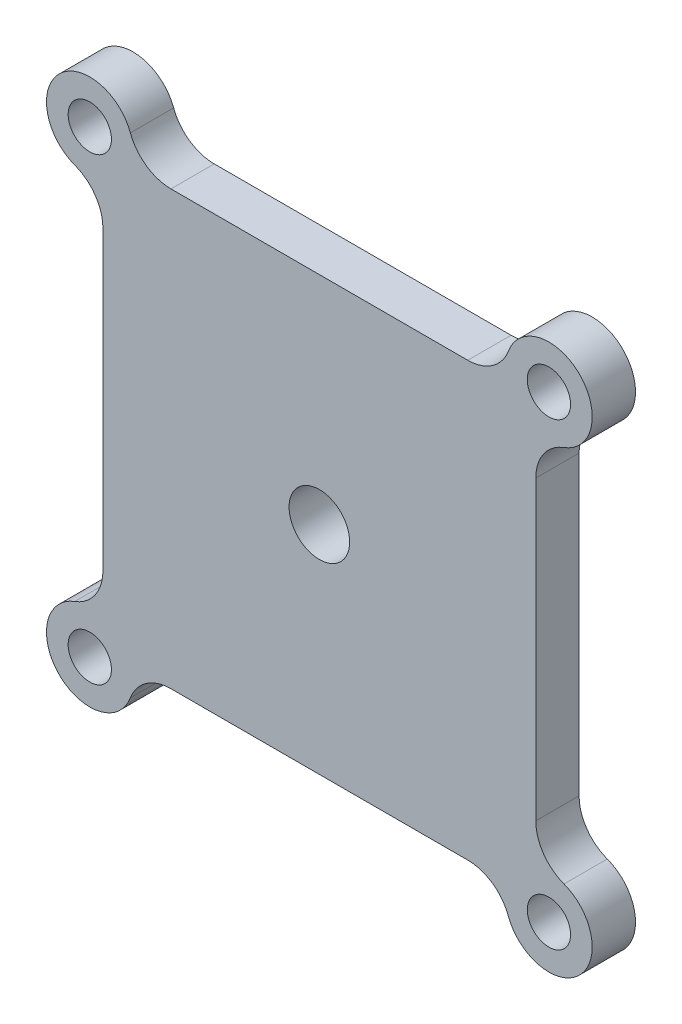
from build123d import *

# Parameters (mm, degrees)
SKETCH_1_R      = 3.5
SKETCH_1_R_2    = 2.5
EXTRUDE_1_DEPTH = 5


with BuildPart() as part:
    # Эскиз1 → Бобышка-Вытянуть1 (new body)
    with BuildSketch(Plane.XY):
        with BuildLine():
            Line((-17.142857316, -25), (17.142857316, -25))
            ThreePointArc((17.142857316, -25), (19.996912391, -25.894592635), (21.829680805, -28.258252147))
            ThreePointArc((21.829680805, -28.258252147), (30.0520382, -30.0520382), (28.258252147, -21.829680805))
            ThreePointArc((28.258252147, -21.829680805), (25.894592635, -19.996912391), (25, -17.142857316))
            Line((25, -17.142857316), (25, 17.142857316))
            ThreePointArc((25, 17.142857316), (25.894592635, 19.996912391), (28.258252147, 21.829680805))
            ThreePointArc((28.258252147, 21.829680805), (30.0520382, 30.0520382), (21.829680805, 28.258252147))
            ThreePointArc((21.829680805, 28.258252147), (19.996912391, 25.894592635), (17.142857316, 25))
            Line((17.142857316, 25), (-17.142857316, 25))
            ThreePointArc((-17.142857316, 25), (-19.996912391, 25.894592635), (-21.829680805, 28.258252147))
            ThreePointArc((-21.829680805, 28.258252147), (-30.0520382, 30.0520382), (-28.258252147, 21.829680805))
            ThreePointArc((-28.258252147, 21.829680805), (-25.894592635, 19.996912391), (-25, 17.142857316))
            Line((-25, 17.142857316), (-25, -17.142857316))
            ThreePointArc((-25, -17.142857316), (-25.894592635, -19.996912391), (-28.258252147, -21.829680805))
            ThreePointArc((-28.258252147, -21.829680805), (-30.0520382, -30.0520382), (-21.829680805, -28.258252147))
            ThreePointArc((-21.829680805, -28.258252147), (-19.996912391, -25.894592635), (-17.142857316, -25))
        make_face()
        Circle(SKETCH_1_R, mode=Mode.SUBTRACT)
        with Locations((-26.516504294, 26.516504295)):
            Circle(SKETCH_1_R_2, mode=Mode.SUBTRACT)
        with Locations((26.516504295, 26.516504294)):
            Circle(SKETCH_1_R_2, mode=Mode.SUBTRACT)
        with Locations((26.516504294, -26.516504295)):
            Circle(SKETCH_1_R_2, mode=Mode.SUBTRACT)
        with Locations((-26.516504295, -26.516504294)):
            Circle(SKETCH_1_R_2, mode=Mode.SUBTRACT)
    extrude(amount=EXTRUDE_1_DEPTH)


solid = part.part
